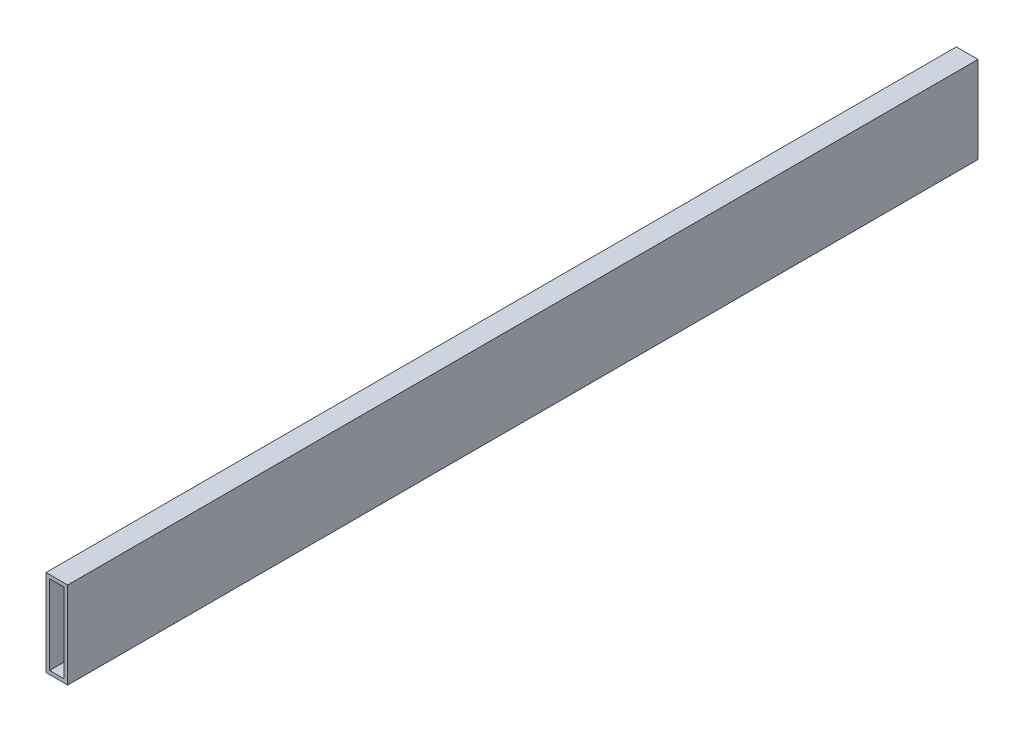
from build123d import *

# Parameters (mm, degrees)
SKETCH1_W           = 19.05
SKETCH1_H           = 76.2
SKETCH1_W_2         = 12.7
SKETCH1_H_2         = 69.85
EXTRUDE_THIN1_DEPTH = 800.1


with BuildPart() as part:
    # Sketch1 → Extrude-Thin1 (new body)
    with BuildSketch(Plane.XY):
        Rectangle(SKETCH1_W, SKETCH1_H)
        Rectangle(SKETCH1_W_2, SKETCH1_H_2, mode=Mode.SUBTRACT)
    extrude(amount=EXTRUDE_THIN1_DEPTH)


solid = part.part
